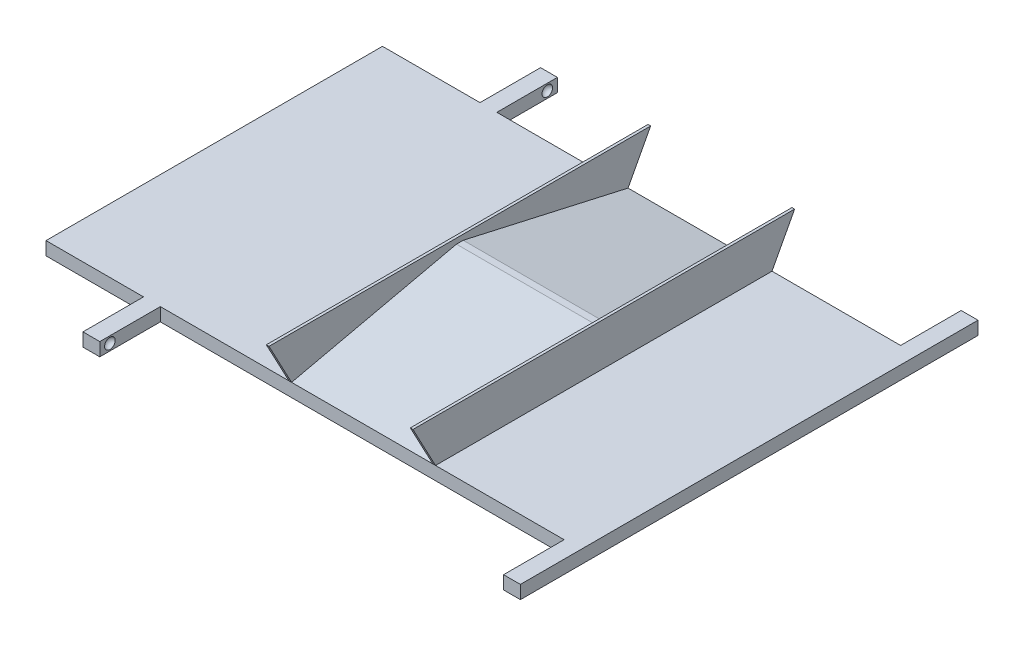
from build123d import *

# Parameters (mm, degrees)
BOSS_EXTRUDE1_DEPTH = 5
BOSS_EXTRUDE2_DEPTH = 1
BOSS_EXTRUDE3_DEPTH = 1


with BuildPart() as part:
    # Sketch1 → Boss-Extrude1 (new body)
    with BuildSketch(Plane(origin=(0, 0, 0), x_dir=(1, 0, 0), z_dir=(0, 1, 0))):
        Polygon((-82.55, -63.5), (-82.55, -86.36), (-76.2, -86.36), (-76.2, -63.5), (76.2, -63.5), (76.2, -86.36), (82.55, -86.36), (82.55, 86.36), (76.2, 86.36), (76.2, 63.5), (-76.2, 63.5), (-76.2, 86.36), (-82.55, 86.36), (-82.55, 63.5), (-119.360030459, 63.5), (-119.360030459, -63.5), align=None)
    extrude(amount=BOSS_EXTRUDE1_DEPTH)

    # Sketch4 → Cut-Revolve3 (revolve, cut)
    with BuildSketch(Plane(origin=(-76.2, 0, 0), x_dir=(0, 0, -1), z_dir=(1, 0, 0))):
        with BuildLine():
            Line((-82.55, 4.5), (-82.55, 0.5))
            ThreePointArc((-82.55, 0.5), (-80.55, 2.5), (-82.55, 4.5))
        make_face()
    revolve(axis=Axis((-76.2, 4.5, 82.55), (0, -1, 0)), mode=Mode.SUBTRACT)

    # Sketch5 → Cut-Revolve4 (revolve, cut)
    with BuildSketch(Plane.ZY.offset(-76.2)):
        with BuildLine():
            Line((82.55, 0.5), (82.55, 4.5))
            ThreePointArc((82.55, 4.5), (84.55, 2.5), (82.55, 0.5))
        make_face()
    revolve(axis=Axis((76.2, 0.5, 82.55), (0, 1, 0)), mode=Mode.SUBTRACT)

    # Sketch7 → Loft1 section 0
    with BuildSketch(Plane(origin=(0, 5, 0), x_dir=(1, 0, 0), z_dir=(0, 1, 0))):
        with BuildLine():
            Line((-26.67, -63.5), (26.67, -63.5))
            Line((26.67, -63.5), (26.67, 63.5))
            Line((26.67, 63.5), (-26.67, 63.5))
            Line((-26.67, 63.5), (-26.67, -63.5))
        make_face()
    # Sketch6 → Loft1 section 1
    with BuildSketch(Plane(origin=(0, 19.05, 0), x_dir=(1, 0, 0), z_dir=(0, 1, 0))):
        with BuildLine():
            Line((26.67, 1.27), (-26.67, 1.27))
            Line((-26.67, 1.27), (-26.67, -1.27))
            Line((-26.67, -1.27), (26.67, -1.27))
            Line((26.67, -1.27), (26.67, 1.27))
        make_face()
    loft()

    # Sketch8 → Cut-Revolve5 (revolve, cut)
    with BuildSketch(Plane(origin=(-76.2, 0, 0), x_dir=(0, 0, -1), z_dir=(1, 0, 0))):
        with BuildLine():
            Line((82.55, 4.5), (82.55, 0.5))
            ThreePointArc((82.55, 0.5), (84.55, 2.5), (82.55, 4.5))
        make_face()
    revolve(axis=Axis((-76.2, 4.5, -82.55), (0, -1, 0)), mode=Mode.SUBTRACT)

    # Sketch9 → Cut-Revolve6 (revolve, cut)
    with BuildSketch(Plane.ZY.offset(-76.2)):
        with BuildLine():
            Line((-82.55, 4.405), (-82.55, 0.595))
            ThreePointArc((-82.55, 0.595), (-80.645, 2.5), (-82.55, 4.405))
        make_face()
    revolve(axis=Axis((76.2, 4.405, -82.55), (0, -1, 0)), mode=Mode.SUBTRACT)

    # Sketch10 → Boss-Extrude2 (add)
    with BuildSketch(Plane(origin=(26.67, 0, 0), x_dir=(0, 0, -1), z_dir=(1, 0, 0))):
        Polygon((-63.5, 5), (63.5, 5), (72.033936378, 21.05), (-72.033936378, 21.05), align=None)
    extrude(amount=BOSS_EXTRUDE2_DEPTH)

    # Sketch11 → Boss-Extrude3 (add)
    with BuildSketch(Plane.ZY.offset(26.67)):
        Polygon((-63.5, 5), (63.5, 5), (72.033936378, 21.05), (-72.033936378, 21.05), align=None)
    extrude(amount=BOSS_EXTRUDE3_DEPTH)


solid = part.part
